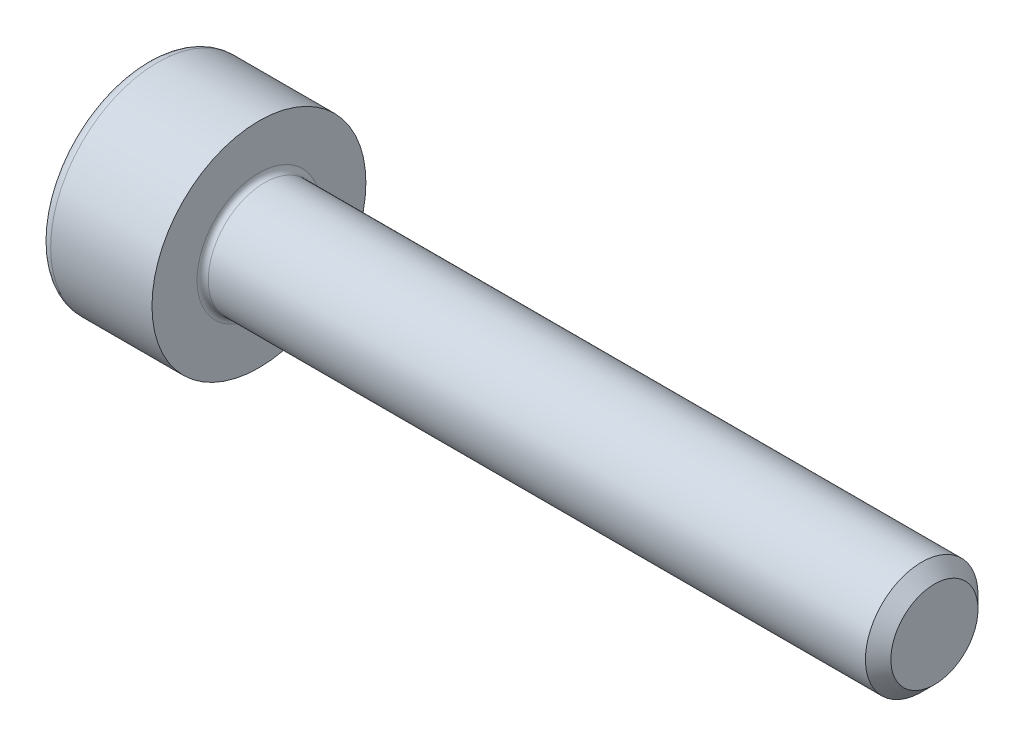
from build123d import *

# Parameters (mm, degrees)
SKETCH_1_W          = 2
SKETCH_1_H          = 1.9
SKETCH_2_R          = 1
EXTRUDE_1_DEPTH     = 12
CUT_EXTRUDE_1_DEPTH = 1
CHAMFER_1_SIZE      = 0.226
FILLET_1_R          = 0.1
FILLET_2_R          = 0.2


with BuildPart() as part:
    # Эскиз1 → Повернуть1 (revolve)
    with BuildSketch(Plane(origin=(0, 0, 0), x_dir=(-1, 0, 0), z_dir=(0, 0, -1)), mode=Mode.PRIVATE) as revolve_1_sk:
        with Locations((-1, 0.95)):
            Rectangle(SKETCH_1_W, SKETCH_1_H)
    revolve(revolve_1_sk.sketch.rotate(Axis((2, 0, 0), (-1, 0, 0)), 270), axis=Axis((2, 0, 0), (-1, 0, 0)))

    # Эскиз2 → Бобышка-Вытянуть1 (add)
    with BuildSketch(Plane(origin=(2, 0, 0), x_dir=(0, 0, -1), z_dir=(1, 0, 0))):
        Circle(SKETCH_2_R)
    extrude(amount=EXTRUDE_1_DEPTH)

    # Эскиз3 → Вырез-Вытянуть1 (cut)
    with BuildSketch(Plane.ZY):
        Polygon((-0.76, -0.438786205), (0, -0.877572409), (0.76, -0.438786205), (0.76, 0.438786205), (0, 0.877572409), (-0.76, 0.438786205), align=None)
    extrude(amount=-CUT_EXTRUDE_1_DEPTH, mode=Mode.SUBTRACT)

    # Эскиз4 → Вырез-Повернуть1 (revolve, cut)
    with BuildSketch(Plane.XY, mode=Mode.PRIVATE) as cut_revolve_1_sk:
        Polygon((1, 0.76), (1, 0), (1.438786205, 0), align=None)
    revolve(cut_revolve_1_sk.sketch.rotate(Axis((0.999975, 0, 0), (1, 0, 0)), 90), axis=Axis((0.999975, 0, 0), (1, 0, 0)), mode=Mode.SUBTRACT)

    # Фаска1
    chamfer_1_edges = [part.edges().sort_by_distance(p)[0] for p in [
        (14, 0, 1),
    ]]
    chamfer(chamfer_1_edges, length=CHAMFER_1_SIZE)

    # Скругление1
    fillet_1_edges = [part.edges().sort_by_distance(p)[0] for p in [
        (2, 0, 1),
    ]]
    fillet(fillet_1_edges, radius=FILLET_1_R)

    # Скругление2
    fillet_2_edges = [part.edges().sort_by_distance(p)[0] for p in [
        (0, 0, -1.9),
    ]]
    fillet(fillet_2_edges, radius=FILLET_2_R)


solid = part.part
